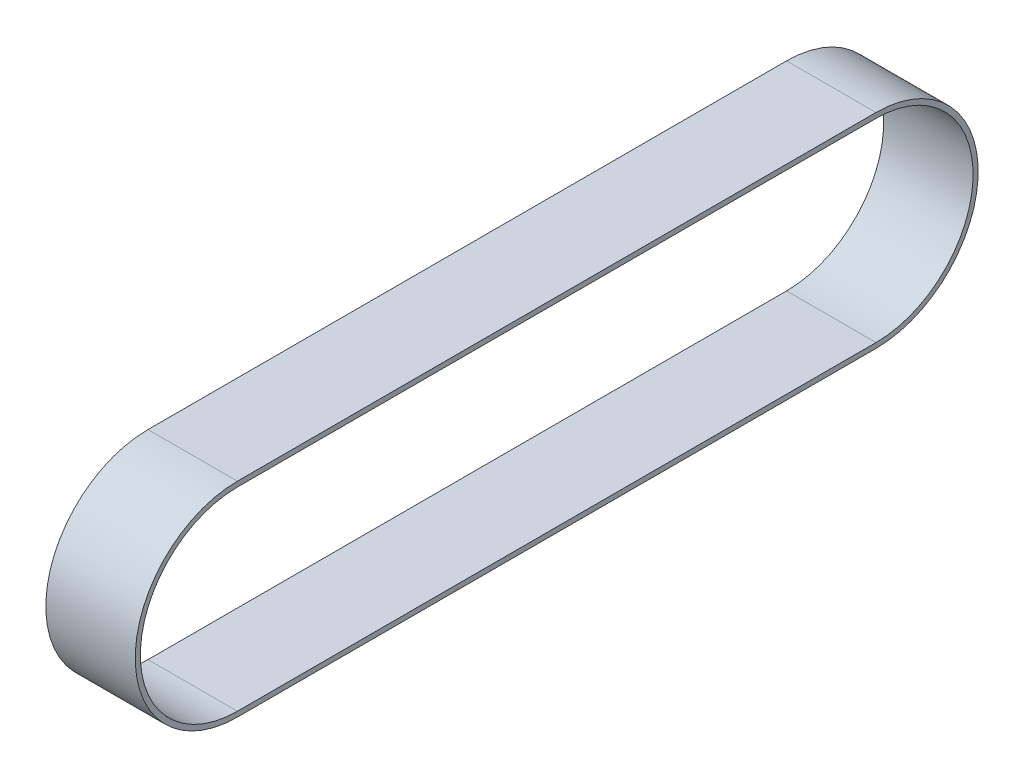
from build123d import *

# Parameters (mm, degrees)
BOSS_EXTRUDE1_DEPTH = 35


with BuildPart() as part:
    # Sketch1 → Boss-Extrude1 (new body)
    with BuildSketch(Plane(origin=(0, 0, 0), x_dir=(0, 0, -1), z_dir=(1, 0, 0))):
        with BuildLine():
            Line((0, -40), (-250, -40))
            ThreePointArc((-250, -40), (-290, 0), (-250, 40))
            Line((-250, 40), (0, 40))
            ThreePointArc((0, 40), (40, 0), (0, -40))
        make_face()
        with BuildLine():
            Line((0, -38), (-250, -38))
            ThreePointArc((-250, -38), (-288, 0), (-250, 38))
            Line((-250, 38), (0, 38))
            ThreePointArc((0, 38), (38, 0), (0, -38))
        make_face(mode=Mode.SUBTRACT)
    extrude(amount=BOSS_EXTRUDE1_DEPTH)


solid = part.part
